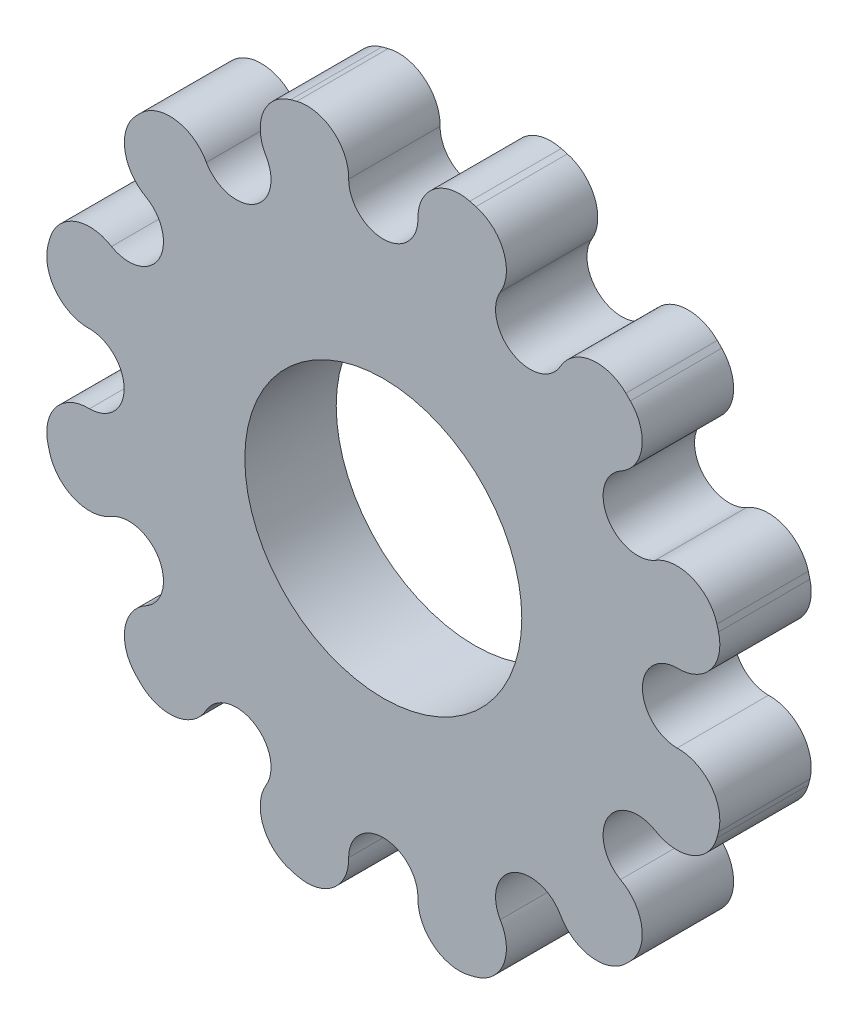
from build123d import *

# Parameters (mm, degrees)
SKETCH1_R           = 31.75
SKETCH1_R_2         = 12.7
BOSS_EXTRUDE1_DEPTH = 8.382
CUT_EXTRUDE1_DEPTH  = 11.43
CIRPATTERN1_COUNT   = 12


with BuildPart() as part:
    # Sketch1 → Boss-Extrude1 (new body)
    with BuildSketch(Plane.XY):
        Circle(SKETCH1_R)
        Circle(SKETCH1_R_2, mode=Mode.SUBTRACT)
    extrude(amount=BOSS_EXTRUDE1_DEPTH)

    # Sketch2 → Cut-Extrude1 (cut)
    with BuildSketch(Plane.XY.offset(8.382)):
        with BuildLine():
            Line((-7.9375, 30.741805311), (-7.9375, 33.926877276))
            Line((-7.9375, 33.926877276), (7.9375, 33.926877276))
            Line((7.9375, 33.926877276), (7.9375, 30.741805311))
            ThreePointArc((7.9375, 30.741805311), (4.60906835, 30.031219266), (3.176555189, 26.943939587))
            ThreePointArc((3.176555189, 26.943939587), (0, 23.767384397), (-3.176555189, 26.943939587))
            ThreePointArc((-3.176555189, 26.943939587), (-4.60906835, 30.031219266), (-7.9375, 30.741805311))
        make_face()
    cut_extrude1 = extrude(amount=-CUT_EXTRUDE1_DEPTH, mode=Mode.SUBTRACT)

    # CirPattern1: Cut-Extrude1 ×12 about axis
    cirpattern1_axis = Axis((0, 0, 0), (0, 0, 1))
    for i in range(1, CIRPATTERN1_COUNT):
        add(cut_extrude1.rotate(cirpattern1_axis, i * 360 / CIRPATTERN1_COUNT), mode=Mode.SUBTRACT)


solid = part.part
